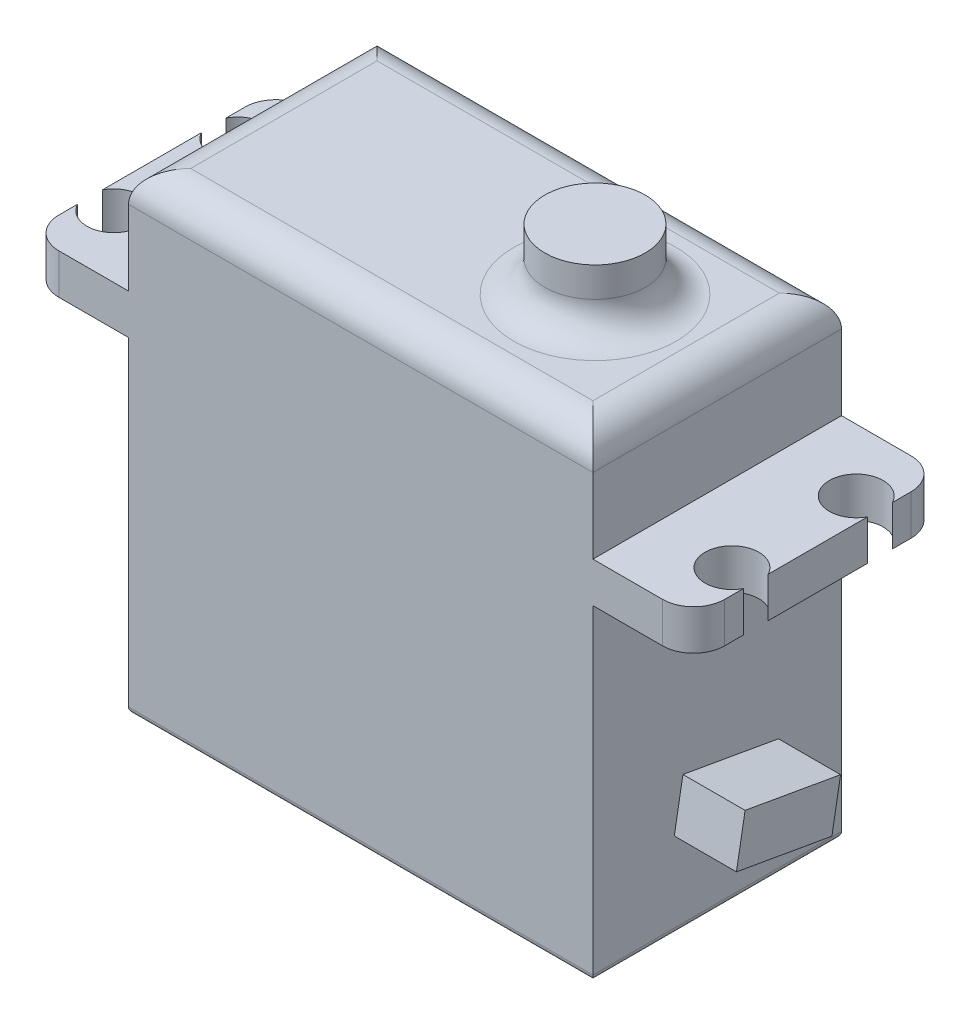
from build123d import *

# Parameters (mm, degrees)
BOSS_EXTRUDE2_DEPTH   = 3.24
BOSS_EXTRUDE2_2_DEPTH = 3.24
SKETCH1_5_W           = 37.369599927
SKETCH1_5_H           = 20
BOSS_EXTRUDE3_DEPTH   = 11.78
SKETCH2_R             = 4.04
BOSS_EXTRUDE4_DEPTH   = 4.9
FILLET5_R             = 2.5
SKETCH1_6_W           = 37.369599927
SKETCH1_6_H           = 20
BOSS_EXTRUDE8_DEPTH   = 16.74
BOSS_EXTRUDE9_DEPTH   = 5
SKETCH7_W             = 37.369599927
SKETCH7_H             = 20
BOSS_EXTRUDE10_DEPTH  = 9.5
FILLET6_R             = 0.5
CUT_EXTRUDE2_DEPTH    = 1.66


with BuildPart() as part:
    # Sketch1 → Boss-Extrude2 (new body)
    with BuildSketch(Plane(origin=(0, 0, 0), x_dir=(1, 0, 0), z_dir=(0, 1, 0))):
        with BuildLine():
            ThreePointArc((27.25, 4), (23.175424329, 5), (27.25, 6))
            Line((27.25, 6), (27.25, 7.5))
            ThreePointArc((27.25, 7.5), (26.517766953, 9.267766953), (24.75, 10))
            Line((24.75, 10), (19.15, 10))
            Line((19.15, 10), (19.15, -10))
            Line((19.15, -10), (24.75, -10))
            ThreePointArc((24.75, -10), (26.517766953, -9.267766953), (27.25, -7.5))
            Line((27.25, -7.5), (27.25, -6))
            ThreePointArc((27.25, -6), (23.175424329, -5), (27.25, -4))
            Line((27.25, -4), (27.25, 4))
        make_face()
    extrude(amount=BOSS_EXTRUDE2_DEPTH)



with BuildPart() as body_2:
    # Sketch1 → Boss-Extrude2 2 (new body)
    with BuildSketch(Plane(origin=(0, 0, 0), x_dir=(1, 0, 0), z_dir=(0, 1, 0))):
        with BuildLine():
            Line((-18.219599927, -10), (-18.219599927, 10))
            Line((-18.219599927, 10), (-23.852132603, 10))
            ThreePointArc((-23.852132603, 10), (-25.619899556, 9.267766953), (-26.352132603, 7.5))
            Line((-26.352132603, 7.5), (-26.352132603, 5.968724559))
            ThreePointArc((-26.352132603, 5.968724559), (-22.261829683, 5.035135291), (-26.319599927, 3.96898917))
            Line((-26.319599927, 3.96898917), (-26.319599927, -4))
            ThreePointArc((-26.319599927, -4), (-22.245024256, -5), (-26.319599927, -6))
            Line((-26.319599927, -6), (-26.319599927, -7.5))
            ThreePointArc((-26.319599927, -7.5), (-25.58736688, -9.267766953), (-23.819599927, -10))
            Line((-23.819599927, -10), (-18.219599927, -10))
        make_face()
    extrude(amount=BOSS_EXTRUDE2_2_DEPTH)


with BuildPart() as part_1:
    add(part.part)

    add(body_2.part)  # Boss-Extrude3 merges body 2
    # Sketch1<5> → Boss-Extrude3 (add)
    with BuildSketch(Plane(origin=(0, 0, 0), x_dir=(1, 0, 0), z_dir=(0, 1, 0))):
        with Locations((0.465200037, 0)):
            Rectangle(SKETCH1_5_W, SKETCH1_5_H)
    extrude(amount=BOSS_EXTRUDE3_DEPTH)

    # Sketch2 → Boss-Extrude4 (add)
    with BuildSketch(Plane(origin=(0, 11.78, 0), x_dir=(1, 0, 0), z_dir=(0, 1, 0))):
        with Locations((9.316469078, 0)):
            Circle(SKETCH2_R)
    extrude(amount=BOSS_EXTRUDE4_DEPTH)

    # Fillet5
    fillet5_edges = [part_1.edges().sort_by_distance(p)[0] for p in [
        (0.465200037, 11.78, 10),
        (-18.219599927, 11.78, 0),
        (0.465200037, 11.78, -10),
        (19.15, 11.78, 0),
        (5.276469078, 11.78, 0),
    ]]
    fillet(fillet5_edges, radius=FILLET5_R)

    # Sketch1<6> → Boss-Extrude8 (add)
    with BuildSketch(Plane(origin=(0, 0, 0), x_dir=(1, 0, 0), z_dir=(0, 1, 0))):
        with Locations((0.465200037, 0)):
            Rectangle(SKETCH1_6_W, SKETCH1_6_H)
    extrude(amount=-BOSS_EXTRUDE8_DEPTH)

    # Sketch6 → Boss-Extrude9 (add)
    with BuildSketch(Plane(origin=(19.15, 0, 0), x_dir=(0, 0, -1), z_dir=(1, 0, 0))):
        Polygon((-2.757398298, -15.385544214), (4.924102175, -16.74), (4.229509465, -20.679231012), (-3.451991009, -19.324775226), align=None)
    extrude(amount=BOSS_EXTRUDE9_DEPTH)

    # Sketch7 → Boss-Extrude10 (add)
    with BuildSketch(Plane.XZ.offset(16.74)):
        with Locations((0.465200037, 0)):
            Rectangle(SKETCH7_W, SKETCH7_H)
    extrude(amount=BOSS_EXTRUDE10_DEPTH)

    # Fillet6
    fillet6_edges = [part_1.edges().sort_by_distance(p)[0] for p in [
        (0.465200037, -26.24, 10),
        (19.15, -26.24, 0),
        (0.465200037, -26.24, -10),
        (-18.219599927, -26.24, 0),
    ]]
    fillet(fillet6_edges, radius=FILLET6_R)

    # Sketch8 → Cut-Extrude2 (cut)
    with BuildSketch(Plane.XZ.offset(26.24)):
        with BuildLine():
            Line((14.19, 9.5), (14.19, 7.07))
            ThreePointArc((14.19, 7.07), (14.784573234, 5.634573234), (16.22, 5.04))
            Line((16.22, 5.04), (18.65, 5.04))
            Line((18.65, 5.04), (18.65, 9.5))
            Line((18.65, 9.5), (14.19, 9.5))
        make_face()
        with BuildLine():
            Line((-13.259599927, 7.07), (-13.259599927, 9.5))
            Line((-13.259599927, 9.5), (-17.719599927, 9.5))
            Line((-17.719599927, 9.5), (-17.719599927, 5.04))
            Line((-17.719599927, 5.04), (-15.289599927, 5.04))
            ThreePointArc((-15.289599927, 5.04), (-13.854173161, 5.634573234), (-13.259599927, 7.07))
        make_face()
        with BuildLine():
            Line((18.65, -9.5), (18.65, -5.04))
            Line((18.65, -5.04), (16.22, -5.04))
            ThreePointArc((16.22, -5.04), (14.784573234, -5.634573234), (14.19, -7.07))
            Line((14.19, -7.07), (14.19, -9.5))
            Line((14.19, -9.5), (18.65, -9.5))
        make_face()
        with BuildLine():
            Line((-15.289599927, -5.04), (-17.719599927, -5.04))
            Line((-17.719599927, -5.04), (-17.719599927, -9.5))
            Line((-17.719599927, -9.5), (-13.259599927, -9.5))
            Line((-13.259599927, -9.5), (-13.259599927, -7.07))
            ThreePointArc((-13.259599927, -7.07), (-13.854173161, -5.634573234), (-15.289599927, -5.04))
        make_face()
    extrude(amount=-CUT_EXTRUDE2_DEPTH, mode=Mode.SUBTRACT)


solid = part_1.part
